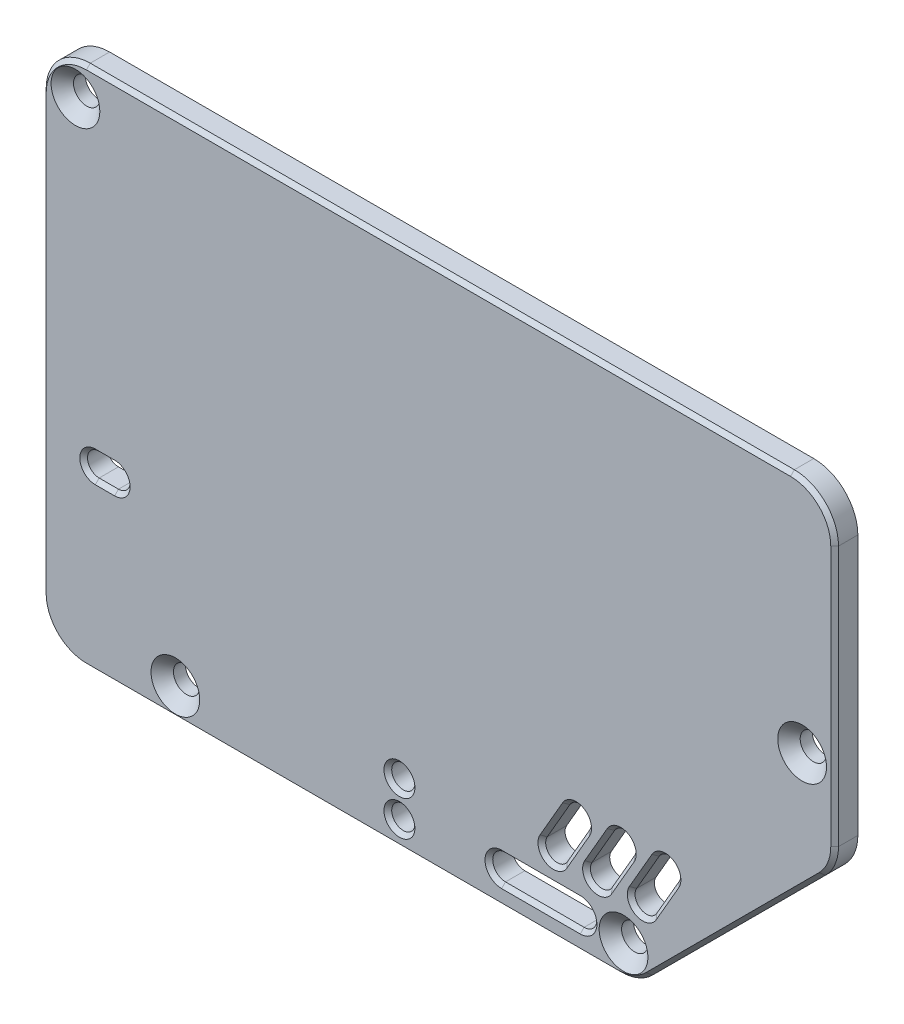
from build123d import *

# Parameters (mm, degrees)
BOSS_EXTRUDE1_DEPTH                            = 3
CSK_FOR_M3_FLAT_HEAD_MACHINE_SCREW1_AT_2_COUNT = 2
CSK_FOR_M3_FLAT_HEAD_MACHINE_SCREW1_AT_2_PITCH = 60.801526997
CSK_FOR_M3_FLAT_HEAD_MACHINE_SCREW1_AT_3_COUNT = 2
CSK_FOR_M3_FLAT_HEAD_MACHINE_SCREW1_AT_3_PITCH = 92.34886737
CSK_FOR_M3_FLAT_HEAD_MACHINE_SCREW1_AT_4_COUNT = 2
CSK_FOR_M3_FLAT_HEAD_MACHINE_SCREW1_AT_4_PITCH = 97.558137473
CUT_EXTRUDE1_DEPTH                             = 121.966441627
SKETCH8_R                                      = 1
CUT_EXTRUDE2_DEPTH                             = 10
SKETCH10_R                                     = 1
CUT_EXTRUDE4_DEPTH                             = 10
SKETCH12_R                                     = 1.5
CUT_EXTRUDE5_DEPTH                             = 10
CHAMFER2_SIZE                                  = 0.5


with BuildPart() as part:
    # Sketch2 → Boss-Extrude1 (new body)
    with BuildSketch(Plane.XY.offset(8.62)):
        with BuildLine():
            Line((4.5, 66.2), (95.5, 66.2))
            ThreePointArc((95.5, 66.2), (99.530508653, 64.530508653), (101.2, 60.5))
            Line((101.2, 60.5), (101.2, 26.863961031))
            ThreePointArc((101.2, 26.863961031), (100.766113335, 24.682665466), (99.530508653, 22.833452378))
            Line((99.530508653, 22.833452378), (77.166547622, 0.469491347))
            ThreePointArc((77.166547622, 0.469491347), (75.317334534, -0.766113335), (73.136038969, -1.2))
            Line((73.136038969, -1.2), (4.5, -1.2))
            ThreePointArc((4.5, -1.2), (0.469491347, 0.469491347), (-1.2, 4.5))
            Line((-1.2, 4.5), (-1.2, 60.5))
            ThreePointArc((-1.2, 60.5), (0.469491347, 64.530508653), (4.5, 66.2))
        make_face()
    extrude(amount=BOSS_EXTRUDE1_DEPTH)

    # Sketch5 → CSK for M3 Flat Head Machine Screw1 (revolve, cut)
    with BuildSketch(Plane(origin=(3.085786438, 61.914213562, 11.62), x_dir=(0, -1, 0), z_dir=(1, 0, 0))):
        Polygon((0, 0), (0, 3), (1.7, 3), (1.7, 1.45), (3.15, 0), align=None)
    csk_for_m3_flat_head_machine_screw1 = revolve(axis=Axis((3.085786438, 61.914213562, 17.97), (0, 0, -1)), mode=Mode.SUBTRACT)

    # CSK for M3 Flat Head Machine Screw1 at 2: CSK for M3 Flat Head Machine Screw1 ×2
    with Locations(*[Vector(0.21239949389766488, -0.9771829178777205, 0) * (i * CSK_FOR_M3_FLAT_HEAD_MACHINE_SCREW1_AT_2_PITCH) for i in range(1, CSK_FOR_M3_FLAT_HEAD_MACHINE_SCREW1_AT_2_COUNT)]):
        add(csk_for_m3_flat_head_machine_screw1, mode=Mode.SUBTRACT)

    # CSK for M3 Flat Head Machine Screw1 at 3: CSK for M3 Flat Head Machine Screw1 ×2
    with Locations(*[Vector(0.7670014457738275, -0.6416453710429606, 0) * (i * CSK_FOR_M3_FLAT_HEAD_MACHINE_SCREW1_AT_3_PITCH) for i in range(1, CSK_FOR_M3_FLAT_HEAD_MACHINE_SCREW1_AT_3_COUNT)]):
        add(csk_for_m3_flat_head_machine_screw1, mode=Mode.SUBTRACT)

    # CSK for M3 Flat Head Machine Screw1 at 4: CSK for M3 Flat Head Machine Screw1 ×2
    with Locations(*[Vector(0.9626486933350611, -0.27075356548030866, 0) * (i * CSK_FOR_M3_FLAT_HEAD_MACHINE_SCREW1_AT_4_PITCH) for i in range(1, CSK_FOR_M3_FLAT_HEAD_MACHINE_SCREW1_AT_4_COUNT)]):
        add(csk_for_m3_flat_head_machine_screw1, mode=Mode.SUBTRACT)

    # Sketch6 → Cut-Extrude1 (cut, through all)
    with BuildSketch(Plane.XY.offset(11.62)):
        with BuildLine():
            Line((68.326, 1.397), (58.166, 1.397))
            ThreePointArc((58.166, 1.397), (56.515, 3.048), (58.166, 4.699))
            Line((58.166, 4.699), (68.326, 4.699))
            ThreePointArc((68.326, 4.699), (69.977, 3.048), (68.326, 1.397))
        make_face()
    extrude(amount=-CUT_EXTRUDE1_DEPTH, mode=Mode.SUBTRACT)

    # Sketch8 → Cut-Extrude2 (cut)
    with BuildSketch(Plane.XY.offset(11.62)):
        with Locations((44.958, 2.539999994)):
            Circle(SKETCH8_R)
        with Locations((44.958000001, 6.095999994)):
            Circle(SKETCH8_R)
    extrude(amount=-CUT_EXTRUDE2_DEPTH, mode=Mode.SUBTRACT)

    # Sketch10 → Cut-Extrude4 (cut)
    with BuildSketch(Plane.XY.offset(11.62)):
        with Locations((5.147878003, 21.843999999)):
            Circle(SKETCH10_R)
        with Locations((8.647878003, 21.843999999)):
            Circle(SKETCH10_R)
    extrude(amount=-CUT_EXTRUDE4_DEPTH, mode=Mode.SUBTRACT)

    # Sketch12 → Cut-Extrude5 (cut)
    with BuildSketch(Plane.XY.offset(11.62)):
        with Locations((44.958000001, 6.595999994)):
            Circle(SKETCH12_R)
        with Locations((44.958000001, 2.039999994)):
            Circle(SKETCH12_R)
        with BuildLine():
            Line((5.647878003, 23.343999999), (8.147878003, 23.343999999))
            ThreePointArc((8.147878003, 23.343999999), (9.647878003, 21.843999999), (8.147878003, 20.343999999))
            Line((8.147878003, 20.343999999), (5.647878003, 20.343999999))
            ThreePointArc((5.647878003, 20.343999999), (4.147878003, 21.843999999), (5.647878003, 23.343999999))
        make_face()
        with BuildLine():
            Line((69.33347303, 9.140911087), (72.256122761, 14.203088914))
            ThreePointArc((72.256122761, 14.203088914), (74.305160867, 14.752127019), (74.854198973, 12.703088914))
            Line((74.854198973, 12.703088914), (71.931549242, 7.640911087))
            ThreePointArc((71.931549242, 7.640911087), (69.882511136, 7.091872982), (69.33347303, 9.140911087))
        make_face()
        with BuildLine():
            Line((63.559970339, 9.140911087), (66.482620069, 14.203088914))
            ThreePointArc((66.482620069, 14.203088914), (68.531658175, 14.752127019), (69.080696281, 12.703088914))
            Line((69.080696281, 12.703088914), (66.15804655, 7.640911087))
            ThreePointArc((66.15804655, 7.640911087), (64.109008444, 7.091872982), (63.559970339, 9.140911087))
        make_face()
        with BuildLine():
            Line((75.106975722, 9.140911087), (78.029625453, 14.203088914))
            ThreePointArc((78.029625453, 14.203088914), (80.078663559, 14.752127019), (80.627701665, 12.703088914))
            Line((80.627701665, 12.703088914), (77.705051934, 7.640911087))
            ThreePointArc((77.705051934, 7.640911087), (75.656013828, 7.091872982), (75.106975722, 9.140911087))
        make_face()
    extrude(amount=-CUT_EXTRUDE5_DEPTH, mode=Mode.SUBTRACT)

    # Chamfer2
    chamfer2_edges = [part.edges().sort_by_distance(p)[0] for p in [
        (75.317334534, -0.766113335, 11.62),
        (4.147878003, 21.843999999, 11.62),
        (6.897878003, 20.343999999, 11.62),
        (9.647878003, 21.843999999, 11.62),
        (6.897878003, 23.343999999, 11.62),
        (43.458000001, 6.595999994, 11.62),
        (43.458000001, 2.039999994, 11.62),
        (88.348528137, 11.651471863, 11.62),
        (69.882511136, 7.091872982, 11.62),
        (73.392874107, 10.172000001, 11.62),
        (74.305160867, 14.752127019, 11.62),
        (70.794797896, 11.672000001, 11.62),
        (64.109008444, 7.091872982, 11.62),
        (67.619371415, 10.172000001, 11.62),
        (68.531658175, 14.752127019, 11.62),
        (65.021295204, 11.672000001, 11.62),
        (100.766113335, 24.682665466, 11.62),
        (75.656013828, 7.091872982, 11.62),
        (79.166376799, 10.172000001, 11.62),
        (80.078663559, 14.752127019, 11.62),
        (76.568300588, 11.672000001, 11.62),
        (101.2, 43.681980515, 11.62),
        (99.530508653, 64.530508653, 11.62),
        (50, 66.2, 11.62),
        (0.469491347, 64.530508653, 11.62),
        (-1.2, 32.5, 11.62),
        (0.469491347, 0.469491347, 11.62),
        (69.977, 3.048, 11.62),
        (63.246, 4.699, 11.62),
        (56.515, 3.048, 11.62),
        (63.246, 1.397, 11.62),
        (38.818019485, -1.2, 11.62),
    ]]
    chamfer(chamfer2_edges, length=CHAMFER2_SIZE)


solid = part.part
